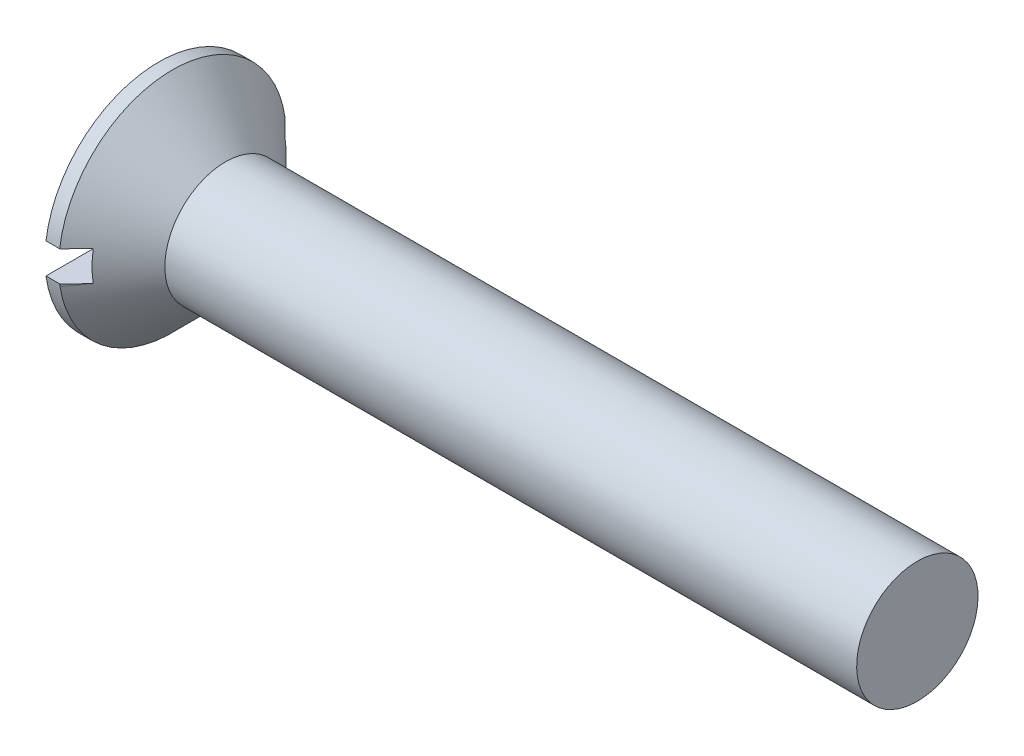
from build123d import *

# Parameters (mm, degrees)
SKETCH2_W          = 7.5
SKETCH2_H          = 1
CUT_EXTRUDE1_DEPTH = 1


with BuildPart() as part:
    # Sketch1 → Revolve1 (revolve)
    with BuildSketch(Plane.XY):
        Polygon((0, 0), (0, 3.75), (0.45, 3.75), (2.2, 2), (25, 2), (25, 0), align=None)
    revolve(axis=Axis((25, 0, 0), (-1, 0, 0)))

    # Sketch2 → Cut-Extrude1 (cut)
    with BuildSketch(Plane.ZY):
        Rectangle(SKETCH2_W, SKETCH2_H)
    extrude(amount=-CUT_EXTRUDE1_DEPTH, mode=Mode.SUBTRACT)


solid = part.part
